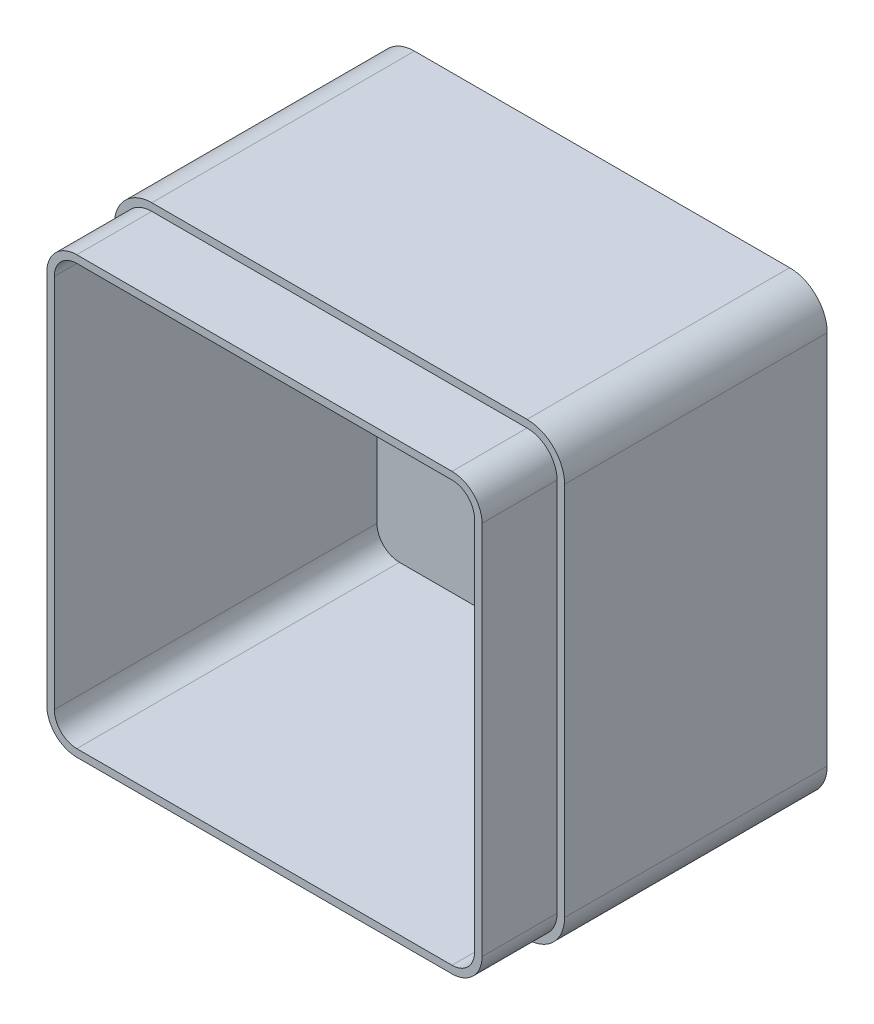
from build123d import *

# Parameters (mm, degrees)
SKETCH2_W           = 120
SKETCH2_H           = 120
BOSS_EXTRUDE1_DEPTH = 90
FILLET1_R           = 10
SHELL1_T            = -4
CUT_EXTRUDE1_DEPTH  = 20


with BuildPart() as part:
    # Sketch2 → Boss-Extrude1 (new body)
    with BuildSketch(Plane.XY):
        with Locations((13.822525597, -28.771331058)):
            Rectangle(SKETCH2_W, SKETCH2_H)
    extrude(amount=BOSS_EXTRUDE1_DEPTH)

    # Fillet1
    fillet1_edges = [part.edges().sort_by_distance(p)[0] for p in [
        (-46.177474403, 31.228668942, 45),
        (73.822525597, 31.228668942, 45),
        (73.822525597, -88.771331058, 45),
        (-46.177474403, -88.771331058, 45),
    ]]
    fillet(fillet1_edges, radius=FILLET1_R)

    # Shell1
    shell1_openings = [part.faces().sort_by_distance(p)[0] for p in [
        (13.822525597, -28.771331058, 90),
    ]]
    offset(amount=SHELL1_T, openings=shell1_openings, kind=Kind.INTERSECTION)

    # Sketch3 → Cut-Extrude1 (cut)
    with BuildSketch(Plane.XY.offset(90)):
        with BuildLine():
            Line((-46.177474403, 21.228668942), (-46.177474403, -78.771331058))
            ThreePointArc((-46.177474403, -78.771331058), (-43.248542215, -85.84239887), (-36.177474403, -88.771331058))
            Line((-36.177474403, -88.771331058), (63.822525597, -88.771331058))
            ThreePointArc((63.822525597, -88.771331058), (70.893593409, -85.84239887), (73.822525597, -78.771331058))
            Line((73.822525597, -78.771331058), (73.822525597, 21.228668942))
            ThreePointArc((73.822525597, 21.228668942), (70.893593409, 28.299736754), (63.822525597, 31.228668942))
            Line((63.822525597, 31.228668942), (-36.177474403, 31.228668942))
            ThreePointArc((-36.177474403, 31.228668942), (-43.248542215, 28.299736754), (-46.177474403, 21.228668942))
        make_face()
        with BuildLine():
            Line((-44.177474403, 21.228668942), (-44.177474403, -78.771331058))
            ThreePointArc((-44.177474403, -78.771331058), (-41.834328652, -84.428185308), (-36.177474403, -86.771331058))
            Line((-36.177474403, -86.771331058), (63.822525597, -86.771331058))
            ThreePointArc((63.822525597, -86.771331058), (69.479379847, -84.428185308), (71.822525597, -78.771331058))
            Line((71.822525597, -78.771331058), (71.822525597, 21.228668942))
            ThreePointArc((71.822525597, 21.228668942), (69.479379847, 26.885523191), (63.822525597, 29.228668942))
            Line((63.822525597, 29.228668942), (-36.177474403, 29.228668942))
            ThreePointArc((-36.177474403, 29.228668942), (-41.834328652, 26.885523191), (-44.177474403, 21.228668942))
        make_face(mode=Mode.SUBTRACT)
    extrude(amount=-CUT_EXTRUDE1_DEPTH, mode=Mode.SUBTRACT)


solid = part.part
